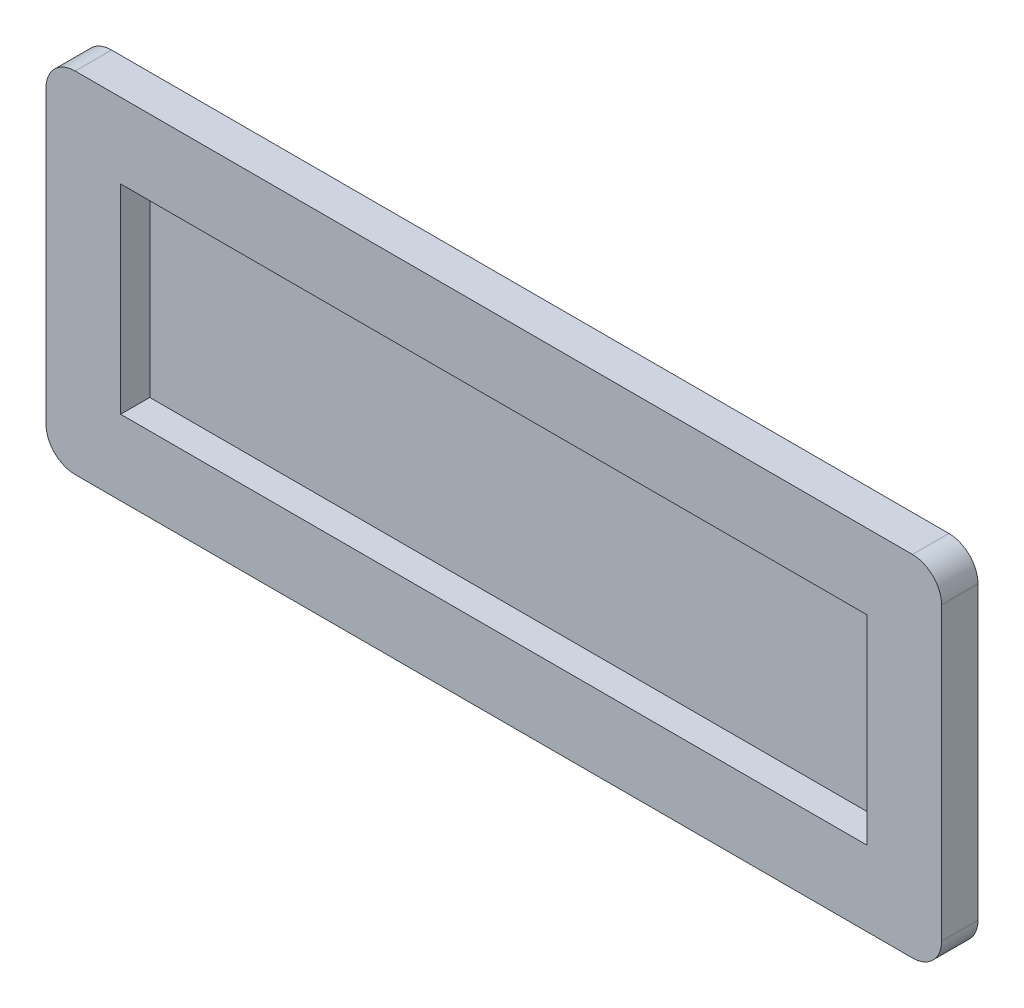
from build123d import *

# Parameters (mm, degrees)
ESQUISSE2_W        = 246
ESQUISSE2_H        = 96
ESQUISSE2_W_2      = 205
ESQUISSE2_H_2      = 54.8
BOSS_EXTRU_1_DEPTH = 10
CONG_1_R           = 8
ESQUISSE3_W        = 205
ESQUISSE3_H        = 54.8
BOSS_EXTRU_2_DEPTH = 2


with BuildPart() as part:
    # Esquisse2 → Boss.-Extru.1 (new body)
    with BuildSketch(Plane.XY):
        with Locations((123, 48)):
            Rectangle(ESQUISSE2_W, ESQUISSE2_H)
        with Locations((123, 48)):
            Rectangle(ESQUISSE2_W_2, ESQUISSE2_H_2, mode=Mode.SUBTRACT)
    extrude(amount=BOSS_EXTRU_1_DEPTH)

    # Congé1
    cong_1_edges = [part.edges().sort_by_distance(p)[0] for p in [
        (0, 96, 5),
        (246, 96, 5),
        (246, 0, 5),
        (0, 0, 5),
    ]]
    fillet(cong_1_edges, radius=CONG_1_R)

    # Esquisse3 → Boss.-Extru.2 (add)
    with BuildSketch(Plane(origin=(0, 0, 0), x_dir=(-1, 0, 0), z_dir=(0, 0, -1))):
        with Locations((-123, 48)):
            Rectangle(ESQUISSE3_W, ESQUISSE3_H)
    extrude(amount=-BOSS_EXTRU_2_DEPTH)


solid = part.part
